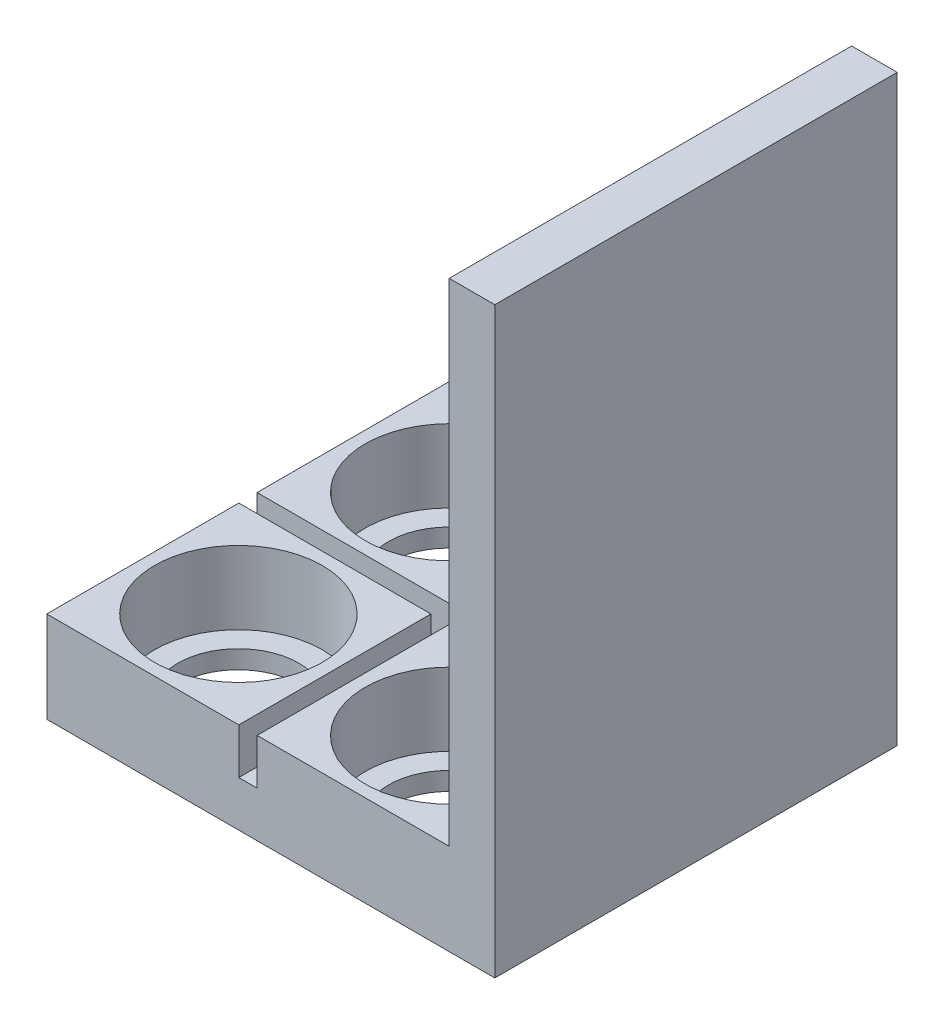
from build123d import *

# Parameters (mm, degrees)
SKETCH1_W               = 44.1
SKETCH1_H               = 44.1
BOSS_EXTRUDE1_DEPTH     = 10
SKETCH2_R               = 9.2
CUT_EXTRUDE1_DEPTH      = 8
SKETCH5_R               = 6.65
CUT_EXTRUDE4_DEPTH      = 50.9501001
MIRROR2_COPY_1_SKETCH_R = 9.2
MIRROR2_COPY_1_DEPTH    = 8
MIRROR2_COPY_2_SKETCH_R = 6.65
MIRROR2_COPY_2_DEPTH    = 50.9501001
CUT_EXTRUDE3_DEPTH      = 5
SKETCH6_W               = 44.1
SKETCH6_H               = 10
BOSS_EXTRUDE2_DEPTH     = 5
SKETCH7_W               = 5
SKETCH7_H               = 44.1
BOSS_EXTRUDE3_DEPTH     = 53.9


with BuildPart() as part:
    # Sketch1 → Boss-Extrude1 (new body)
    with BuildSketch(Plane(origin=(0, 0, 0), x_dir=(1, 0, 0), z_dir=(0, 1, 0))):
        with Locations((22.05, 0)):
            Rectangle(SKETCH1_W, SKETCH1_H)
    extrude(amount=BOSS_EXTRUDE1_DEPTH)

    # Sketch2 → Cut-Extrude1 (cut)
    with BuildSketch(Plane(origin=(0, 10, 0), x_dir=(1, 0, 0), z_dir=(0, 1, 0))):
        with Locations(Location((10.5, 11.55, 0), (0, 0, 270))):
            Circle(SKETCH2_R)
    cut_extrude1 = extrude(amount=-CUT_EXTRUDE1_DEPTH, mode=Mode.SUBTRACT)

    # Sketch5 → Cut-Extrude4 (cut, through all)
    with BuildSketch(Plane(origin=(0, 2, 0), x_dir=(1, 0, 0), z_dir=(0, 1, 0))):
        with Locations(Location((10.5, 11.55, 0), (0, 0, 270))):
            Circle(SKETCH5_R)
    cut_extrude4 = extrude(amount=-CUT_EXTRUDE4_DEPTH, mode=Mode.SUBTRACT)

    # Mirror1: Cut-Extrude1, Cut-Extrude4 across plane
    add(cut_extrude1.mirror(Plane.XY), mode=Mode.SUBTRACT)
    add(cut_extrude4.mirror(Plane.XY), mode=Mode.SUBTRACT)

    # Mirror2: Cut-Extrude1, Cut-Extrude4 across plane
    add(cut_extrude1.mirror(Plane(origin=(22.05, 0, 0), x_dir=(0, 0, 1), z_dir=(1, 0, 0))), mode=Mode.SUBTRACT)
    add(cut_extrude4.mirror(Plane(origin=(22.05, 0, 0), x_dir=(0, 0, 1), z_dir=(1, 0, 0))), mode=Mode.SUBTRACT)

    # Mirror2 copy 1 sketch → Mirror2 copy 1 (cut)
    with BuildSketch(Plane(origin=(44.1, 10, 0), x_dir=(-1, 0, 0), z_dir=(0, 1, 0))):
        with Locations(Location((10.5, 11.55, 0), (0, 0, 270))):
            Circle(MIRROR2_COPY_1_SKETCH_R)
    extrude(amount=-MIRROR2_COPY_1_DEPTH, mode=Mode.SUBTRACT)

    # Mirror2 copy 2 sketch → Mirror2 copy 2 (cut, through all)
    with BuildSketch(Plane(origin=(44.1, 2, 0), x_dir=(-1, 0, 0), z_dir=(0, 1, 0))):
        with Locations(Location((10.5, 11.55, 0), (0, 0, 270))):
            Circle(MIRROR2_COPY_2_SKETCH_R)
    extrude(amount=-MIRROR2_COPY_2_DEPTH, mode=Mode.SUBTRACT)

    # Sketch4 → Cut-Extrude3 (cut)
    with BuildSketch(Plane(origin=(0, 10, 0), x_dir=(1, 0, 0), z_dir=(0, 1, 0))):
        Polygon((21.05, 22.05), (23.05, 22.05), (23.05, 1), (46.251393124, 1), (46.251393124, -1), (23.05, -1), (23.05, -23.362709558), (21.05, -23.362709558), (21.05, -1), (0, -1), (0, 1), (21.05, 1), align=None)
    extrude(amount=-CUT_EXTRUDE3_DEPTH, mode=Mode.SUBTRACT)

    # Sketch6 → Boss-Extrude2 (add)
    with BuildSketch(Plane(origin=(44.1, 0, 0), x_dir=(0, 0, -1), z_dir=(1, 0, 0))):
        with Locations((0, 5)):
            Rectangle(SKETCH6_W, SKETCH6_H)
    extrude(amount=BOSS_EXTRUDE2_DEPTH)

    # Sketch7 → Boss-Extrude3 (add)
    with BuildSketch(Plane(origin=(0, 10, 0), x_dir=(1, 0, 0), z_dir=(0, 1, 0))):
        with Locations((46.6, 0)):
            Rectangle(SKETCH7_W, SKETCH7_H)
    extrude(amount=BOSS_EXTRUDE3_DEPTH)


solid = part.part
